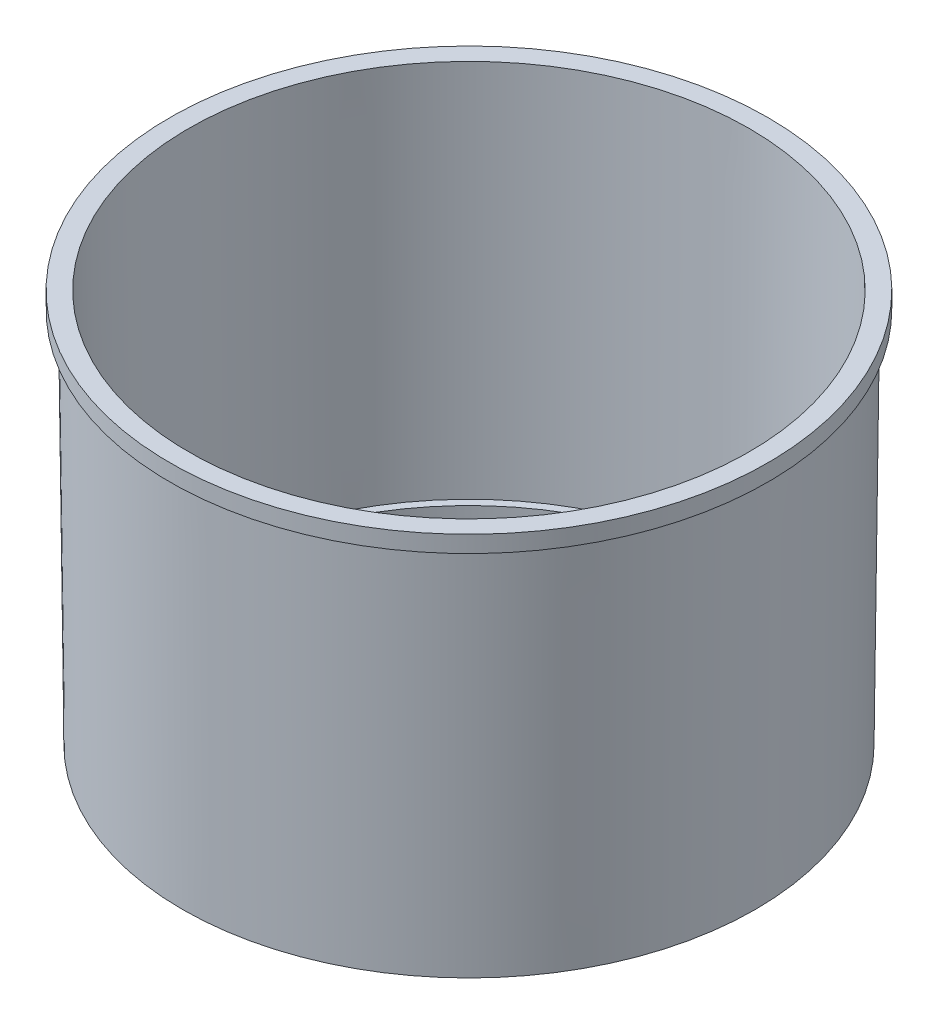
from build123d import *


with BuildPart() as part:
    # 草图3 → 旋转1 (revolve)
    with BuildSketch(Plane.XY, mode=Mode.PRIVATE) as revolve_1_sk:
        Polygon((-34.728791145, 45), (-34.25, 0), (-32.1, 0), (-32.1, 2), (-33.021208855, 2), (-33.5, 47), (-35.75, 47), (-35.75, 45), align=None)
    revolve(revolve_1_sk.sketch.rotate(Axis((0, -2.25, 0), (0, 1, 0)), 270), axis=Axis((0, -2.25, 0), (0, 1, 0)))


solid = part.part
